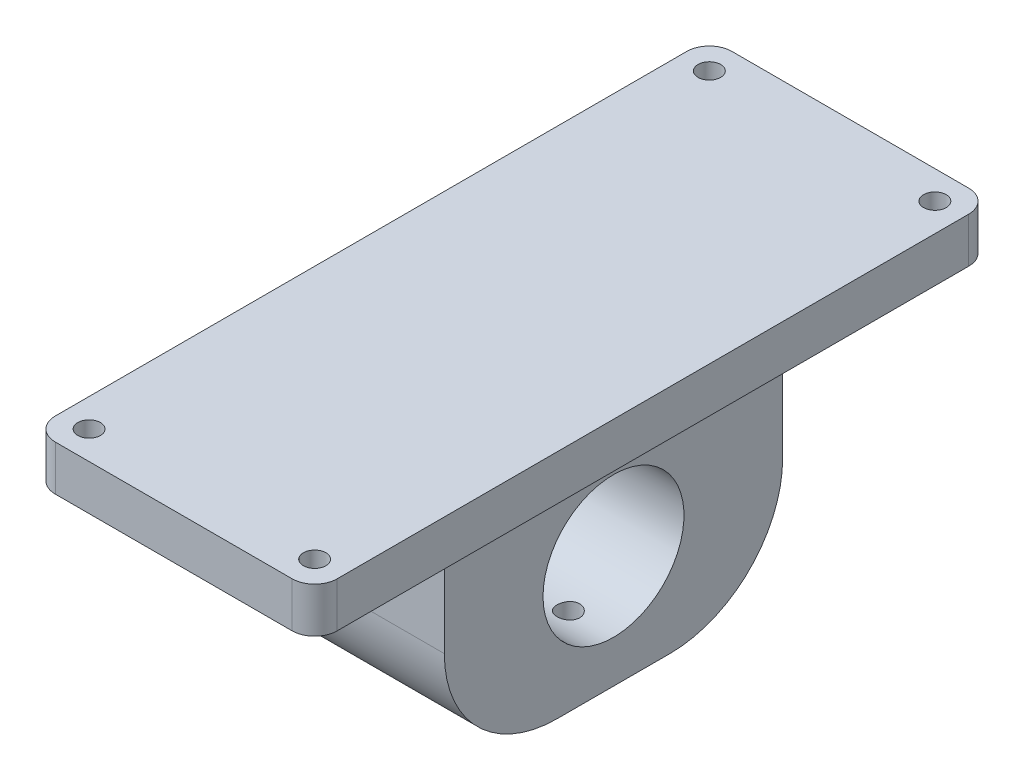
from build123d import *

# Parameters (mm, degrees)
SKETCH1_W                 = 50
SKETCH1_H                 = 120
BOSS_EXTRUDE1_DEPTH       = 8
SKETCH2_R                 = 2
CUT_EXTRUDE1_DEPTH        = 10
LPATTERN1_COUNT           = 2
LPATTERN1_PITCH           = 40
LPATTERN2_COUNT           = 2
LPATTERN2_PITCH           = 110
LPATTERN2_COPY_1_SKETCH_R = 2
LPATTERN2_COPY_1_DEPTH    = 10
BOSS_EXTRUDE2_DEPTH       = 40
SKETCH6_R                 = 12.5
CUT_EXTRUDE2_DEPTH        = 84.958322994
CUT_EXTRUDE3_DEPTH        = 84.958322994
FILLET1_R                 = 4
SKETCH8_R                 = 2
CUT_EXTRUDE4_DEPTH        = 10
SKETCH9_R                 = 2.5
CUT_EXTRUDE5_DEPTH        = 1
LPATTERN3_COUNT           = 2
LPATTERN3_PITCH           = 10
LPATTERN3_COL_COUNT       = 2
LPATTERN3_COL_PITCH       = 10


with BuildPart() as part:
    # Sketch1 → Boss-Extrude1 (new body)
    with BuildSketch(Plane(origin=(0, 0, 0), x_dir=(1, 0, 0), z_dir=(0, 1, 0))):
        with Locations((-110, 0)):
            Rectangle(SKETCH1_W, SKETCH1_H)
    extrude(amount=BOSS_EXTRUDE1_DEPTH)

    # Sketch2 → Cut-Extrude1 (cut)
    with BuildSketch(Plane(origin=(0, 8, 0), x_dir=(1, 0, 0), z_dir=(0, 1, 0))):
        with Locations(Location((-130, 55, 0), (0, 0, 270))):
            Circle(SKETCH2_R)
    cut_extrude1 = extrude(amount=-CUT_EXTRUDE1_DEPTH, mode=Mode.SUBTRACT)

    # LPattern1: Cut-Extrude1 ×2
    with Locations(*[(i * LPATTERN1_PITCH, 0, 0) for i in range(1, LPATTERN1_COUNT)]):
        add(cut_extrude1, mode=Mode.SUBTRACT)

    # LPattern2: Cut-Extrude1 ×2
    with Locations(*[(0, 0, i * LPATTERN2_PITCH) for i in range(1, LPATTERN2_COUNT)]):
        add(cut_extrude1, mode=Mode.SUBTRACT)

    # LPattern2 copy 1 sketch → LPattern2 copy 1 (cut)
    with BuildSketch(Plane(origin=(40, 8, 110), x_dir=(1, 0, 0), z_dir=(0, 1, 0))):
        with Locations(Location((-130, 55, 0), (0, 0, 270))):
            Circle(LPATTERN2_COPY_1_SKETCH_R)
    extrude(amount=-LPATTERN2_COPY_1_DEPTH, mode=Mode.SUBTRACT)

    # Sketch5 → Boss-Extrude2 (add)
    with BuildSketch(Plane.XZ):
        with BuildLine():
            Line((-92, 30), (-92, -30))
            ThreePointArc((-92, -30), (-110, -48), (-128, -30))
            Line((-128, -30), (-128, 30))
            ThreePointArc((-128, 30), (-110, 48), (-92, 30))
        make_face()
    extrude(amount=BOSS_EXTRUDE2_DEPTH)

    # Sketch6 → Cut-Extrude2 (cut, through all)
    with BuildSketch(Plane.ZY.offset(128)):
        with Locations((0, -20)):
            Circle(SKETCH6_R)
    extrude(amount=-CUT_EXTRUDE2_DEPTH, mode=Mode.SUBTRACT)

    # Sketch7 → Cut-Extrude3 (cut, through all)
    with BuildSketch(Plane(origin=(-92, 0, 0), x_dir=(0, 0, -1), z_dir=(1, 0, 0))):
        Polygon((-30, -20), (-30, 0), (-48, 0), (-48, -40), (-30, -40), align=None)
        with BuildLine():
            ThreePointArc((-10, -40), (-24.142135624, -34.142135624), (-30, -20))
            Line((-30, -20), (-30, -40))
            Line((-30, -40), (-10, -40))
        make_face()
        with BuildLine():
            ThreePointArc((30, -20), (24.142135624, -34.142135624), (10, -40))
            Line((10, -40), (30, -40))
            Line((30, -40), (30, -20))
        make_face()
        Polygon((30, -20), (30, -40), (48, -40), (48, 0), (30, 0), align=None)
    extrude(amount=-CUT_EXTRUDE3_DEPTH, mode=Mode.SUBTRACT)

    # Fillet1
    fillet1_edges = [part.edges().sort_by_distance(p)[0] for p in [
        (-85, 4, 60),
        (-135, 4, 60),
        (-135, 4, -60),
        (-85, 4, -60),
    ]]
    fillet(fillet1_edges, radius=FILLET1_R)

    # Sketch8 → Cut-Extrude4 (cut)
    with BuildSketch(Plane.XZ.offset(40)):
        with Locations(Location((-110, 0, 0), (0, 0, 270))):
            Circle(SKETCH8_R)
    cut_extrude4 = extrude(amount=-CUT_EXTRUDE4_DEPTH, mode=Mode.SUBTRACT)

    # Sketch9 → Cut-Extrude5 (cut)
    with BuildSketch(Plane.XZ.offset(40)):
        with Locations(Location((-110, 0, 0), (0, 0, 270))):
            Circle(SKETCH9_R)
    cut_extrude5 = extrude(amount=-CUT_EXTRUDE5_DEPTH, mode=Mode.SUBTRACT)

    # LPattern3: Cut-Extrude4, Cut-Extrude5 ×2
    with Locations(*[(i * LPATTERN3_PITCH, 0, 0) for i in range(1, LPATTERN3_COUNT)]):
        add(cut_extrude4, mode=Mode.SUBTRACT)
        add(cut_extrude5, mode=Mode.SUBTRACT)

    # LPattern3 col: Cut-Extrude4, Cut-Extrude5 ×2
    with Locations(*[(-i * LPATTERN3_COL_PITCH, 0, 0) for i in range(1, LPATTERN3_COL_COUNT)]):
        add(cut_extrude4, mode=Mode.SUBTRACT)
        add(cut_extrude5, mode=Mode.SUBTRACT)


solid = part.part
